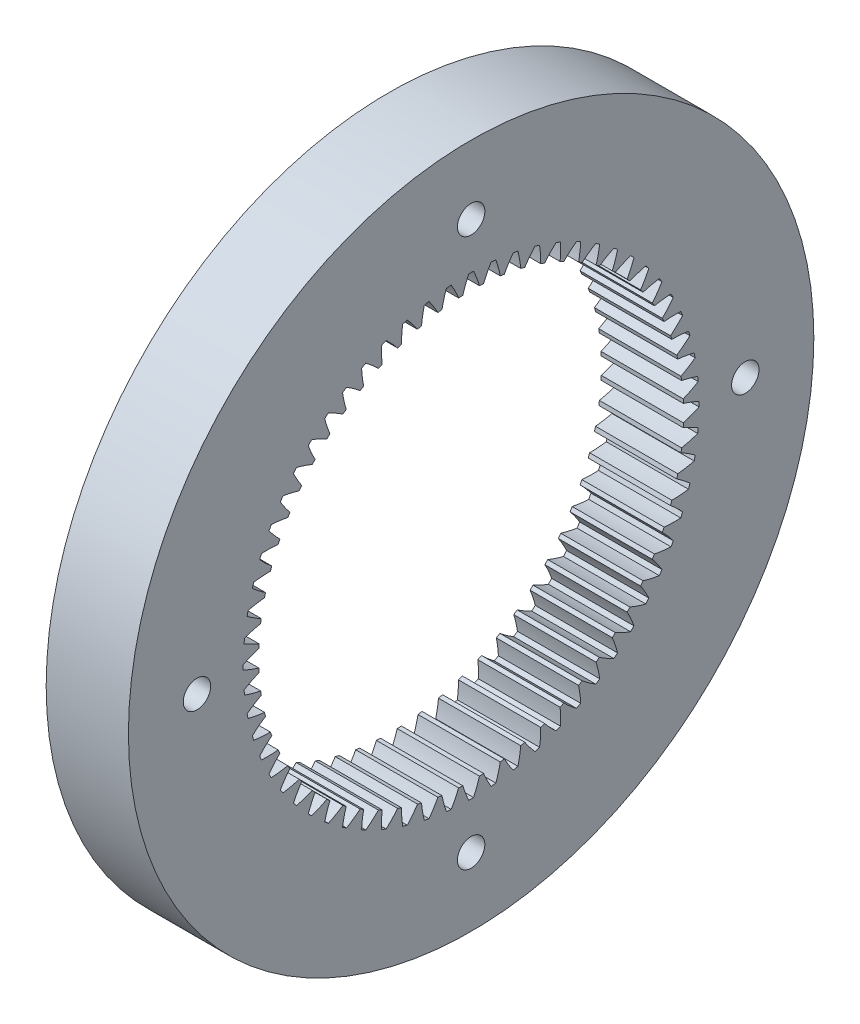
from build123d import *

# Parameters (mm, degrees)
BASPROSKE_W        = 12
BASPROSKE_H        = 19
TOOTHCUT_DEPTH     = 72.721684308
TEETHCUTS_COUNT    = 64
TEETHCUTS_ANGLE    = 354.375
SKETCH1_R          = 2
CUT_EXTRUDE1_DEPTH = 72.721684308


with BuildPart() as part:
    # BasProSke → Base-Revolve (revolve)
    with BuildSketch(Plane(origin=(0, 0, 0), x_dir=(1, 0, 0), z_dir=(0, 1, 0)), mode=Mode.PRIVATE) as base_revolve_sk:
        with Locations((6, 40.5)):
            Rectangle(BASPROSKE_W, BASPROSKE_H)
    revolve(base_revolve_sk.sketch.rotate(Axis((-10, 0, 0), (1, 0, 0)), 180), axis=Axis((-10, 0, 0), (1, 0, 0)))

    # TooCutSke → ToothCut (cut, through all)
    with BuildSketch(Plane(origin=(0, 0, 0), x_dir=(0, 0, -1), z_dir=(1, 0, 0))):
        with BuildLine():
            ThreePointArc((1.226941991, 30.95029012), (0.831716608, 32.116661132), (0.347953381, 33.24917938))
            ThreePointArc((0.347953381, 33.24917938), (0, 33.251), (-0.347953381, 33.24917938))
            ThreePointArc((-0.347953381, 33.24917938), (-0.831716608, 32.116661132), (-1.226941991, 30.95029012))
            ThreePointArc((-1.226941991, 30.95029012), (0, 30.9746), (1.226941991, 30.95029012))
        make_face()
    toothcut = extrude(amount=TOOTHCUT_DEPTH, mode=Mode.SUBTRACT)

    # TeethCuts: ToothCut ×64 about axis
    teethcuts_axis = Axis((-10, 0, 0), (1, 0, 0))
    for i in range(1, TEETHCUTS_COUNT):
        add(toothcut.rotate(teethcuts_axis, i * TEETHCUTS_ANGLE / (TEETHCUTS_COUNT - 1)), mode=Mode.SUBTRACT)

    # Sketch1 → Cut-Extrude1 (cut, through all)
    with BuildSketch(Plane(origin=(12, 0, 0), x_dir=(0, 0, -1), z_dir=(1, 0, 0))):
        with Locations((0, 40)):
            Circle(SKETCH1_R)
        with Locations((0, -40)):
            Circle(SKETCH1_R)
        with Locations((-40, 0)):
            Circle(SKETCH1_R)
        with Locations((40, 0)):
            Circle(SKETCH1_R)
    extrude(amount=-CUT_EXTRUDE1_DEPTH, mode=Mode.SUBTRACT)


solid = part.part
